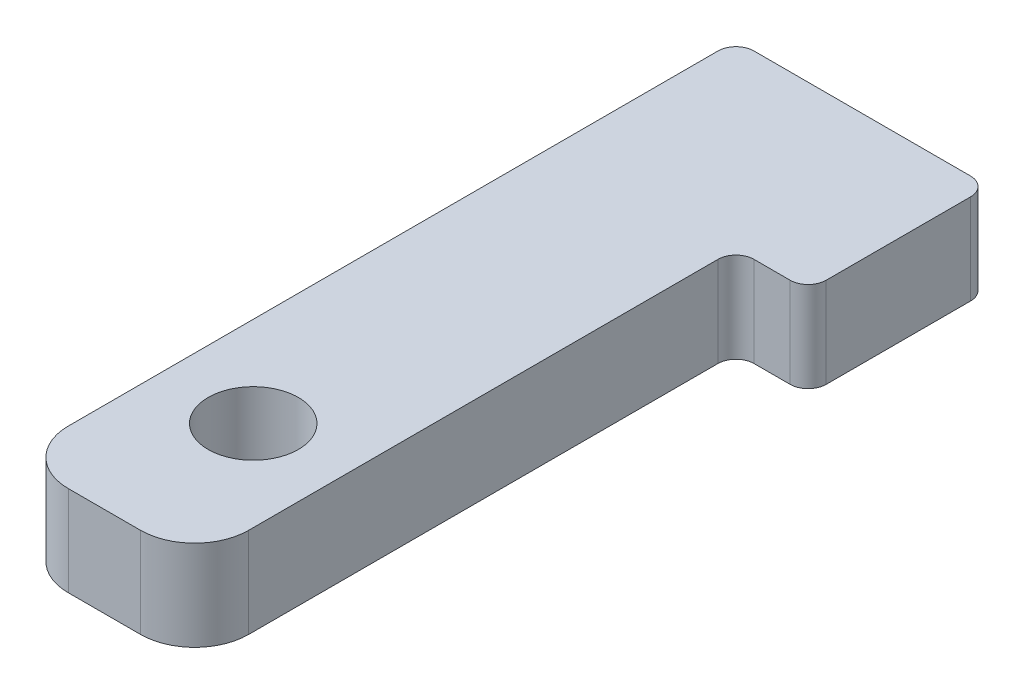
from build123d import *

# Parameters (mm, degrees)
SKETCH_1_R          = 2.5
EXTRUDE_1_DEPTH     = 5
SKETCH_2_W          = 10
SKETCH_2_H          = 5
EXTRUDE_2_DEPTH     = 10
EXTRUDE_3_DEPTH     = 5
CUT_EXTRUDE_1_DEPTH = 43.673176587


with BuildPart() as part:
    # Эскиз1 → Бобышка-Вытянуть1 (new body)
    with BuildSketch(Plane(origin=(0, 0, 0), x_dir=(1, 0, 0), z_dir=(0, 1, 0))):
        with BuildLine():
            Line((3, 0), (7, 0))
            ThreePointArc((7, 0), (9.121320344, 0.878679656), (10, 3))
            Line((10, 3), (10, 30))
            Line((10, 30), (0, 30))
            Line((0, 30), (0, 3))
            ThreePointArc((0, 3), (0.878679656, 0.878679656), (3, 0))
        make_face()
        with Locations(Location((5, 8.25, 0), (0, 0, 270))):
            Circle(SKETCH_1_R, mode=Mode.SUBTRACT)
    extrude(amount=EXTRUDE_1_DEPTH)

    # Эскиз2 → Бобышка-Вытянуть2 (add)
    with BuildSketch(Plane(origin=(0, 0, -30), x_dir=(-1, 0, 0), z_dir=(0, 0, -1))):
        with Locations((-5, 2.5)):
            Rectangle(SKETCH_2_W, SKETCH_2_H)
    extrude(amount=EXTRUDE_2_DEPTH)

    # Эскиз4 → Бобышка-Вытянуть3 (add)
    with BuildSketch(Plane(origin=(0, 5, 0), x_dir=(1, 0, 0), z_dir=(0, 1, 0))):
        with BuildLine():
            Line((13, 40), (10, 40))
            Line((10, 40), (10, 29))
            ThreePointArc((10, 29), (10.292893219, 29.707106781), (11, 30))
            Line((11, 30), (13, 30))
            ThreePointArc((13, 30), (13.707106781, 30.292893219), (14, 31))
            Line((14, 31), (14, 39))
            ThreePointArc((14, 39), (13.707106781, 39.707106781), (13, 40))
        make_face()
    extrude(amount=-EXTRUDE_3_DEPTH)

    # Эскиз5 → Вырез-Вытянуть1 (cut, through all)
    with BuildSketch(Plane(origin=(0, 5, 0), x_dir=(1, 0, 0), z_dir=(0, 1, 0))):
        with BuildLine():
            Line((0, 38.89263227), (0, 39))
            ThreePointArc((0, 39), (0.292893219, 39.707106781), (1, 40))
            Line((1, 40), (1.042017626, 40))
            Line((1.042017626, 40), (0.948883757, 40.294542088))
            Line((0.948883757, 40.294542088), (-0.497142104, 40.245524262))
            Line((-0.497142104, 40.245524262), (-0.497142104, 39.412221223))
            Line((-0.497142104, 39.412221223), (0, 38.89263227))
        make_face()
    extrude(amount=-CUT_EXTRUDE_1_DEPTH, mode=Mode.SUBTRACT)


solid = part.part
